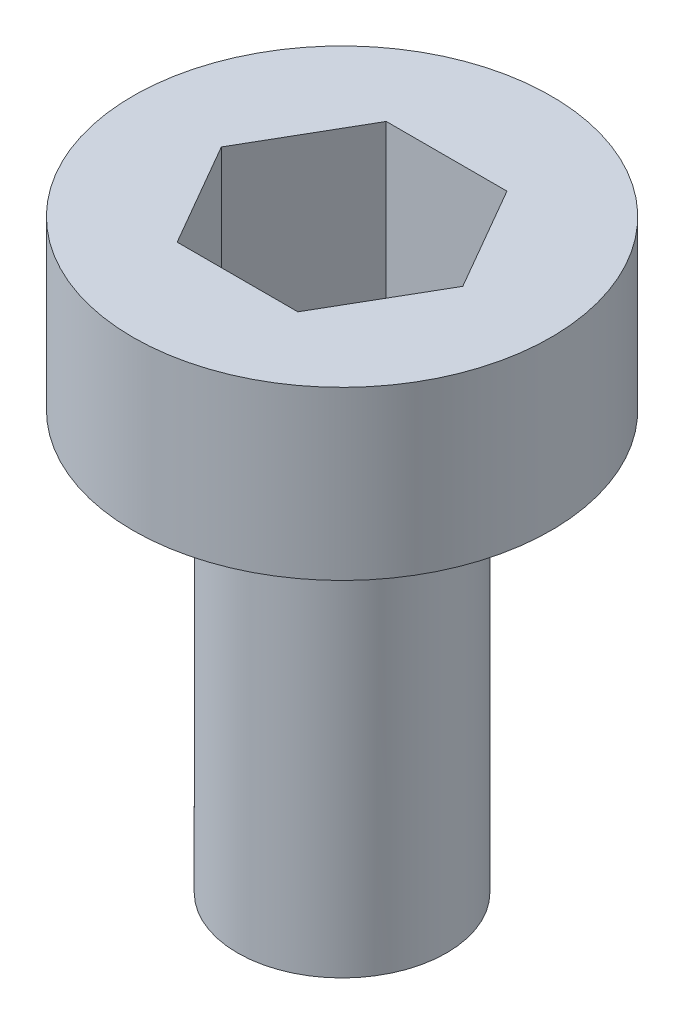
from build123d import *

# Parameters (mm, degrees)
SKETCH1_R      = 2.5
EXTRUDE1_DEPTH = 10
SKETCH2_R      = 5
EXTRUDE2_DEPTH = 4


with BuildPart() as part:
    # Sketch1 → Extrude1 (new body)
    with BuildSketch(Plane(origin=(0, 0, 0), x_dir=(1, 0, 0), z_dir=(0, 1, 0))):
        with Locations(Location((0, 0, 0), (0, 0, 270))):
            Circle(SKETCH1_R)
    extrude(amount=-EXTRUDE1_DEPTH)


with BuildPart() as body_2:
    # Sketch2 → Extrude2 (new body)
    with BuildSketch(Plane(origin=(0, 0, 0), x_dir=(1, 0, 0), z_dir=(0, 1, 0))):
        with Locations(Location((0, 0, 0), (0, 0, 270))):
            Circle(SKETCH2_R)
        Polygon((2.886751346, 0), (1.443375673, 2.5), (-1.443375673, 2.5), (-2.886751346, 0), (-1.443375673, -2.5), (1.443375673, -2.5), align=None, mode=Mode.SUBTRACT)
    extrude(amount=EXTRUDE2_DEPTH)


solid = Compound([part.part, body_2.part])
